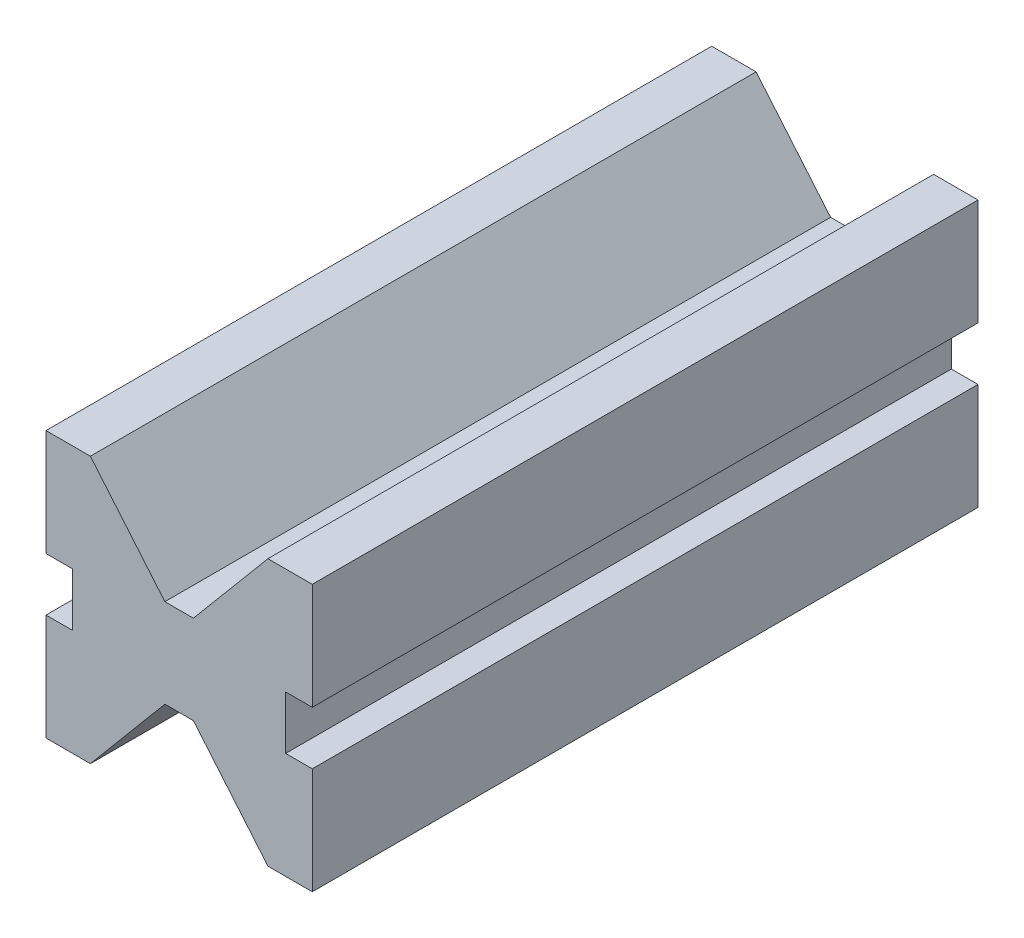
from build123d import *

# Parameters (mm, degrees)
BOSS_EXTRUDE1_DEPTH = 150


with BuildPart() as part:
    # Sketch1 → Boss-Extrude1 (new body)
    with BuildSketch(Plane.XY):
        Polygon((0, 0), (0, 24), (6, 24), (6, 36), (0, 36), (0, 60), (10, 60), (26.781992624, 40), (33.218007376, 40), (50, 60), (60, 60), (60, 36), (54, 36), (54, 24), (60, 24), (60, 0), (50, 0), (33.218007376, 20), (26.781992624, 20), (10, 0), align=None)
    extrude(amount=BOSS_EXTRUDE1_DEPTH)


solid = part.part
